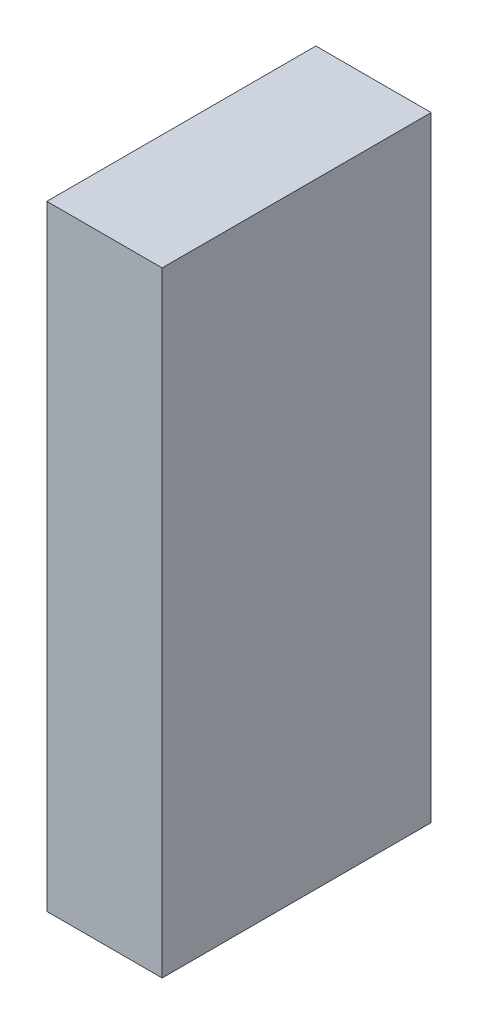
from build123d import *

# Parameters (mm, degrees)
SKETCH1_W           = 38.1
SKETCH1_H           = 88.9
BOSS_EXTRUDE1_DEPTH = 203.2


with BuildPart() as part:
    # Sketch1 → Boss-Extrude1 (new body)
    with BuildSketch(Plane(origin=(0, 0, 0), x_dir=(1, 0, 0), z_dir=(0, 1, 0))):
        with Locations((19.05, 44.45)):
            Rectangle(SKETCH1_W, SKETCH1_H)
    extrude(amount=BOSS_EXTRUDE1_DEPTH)


solid = part.part
